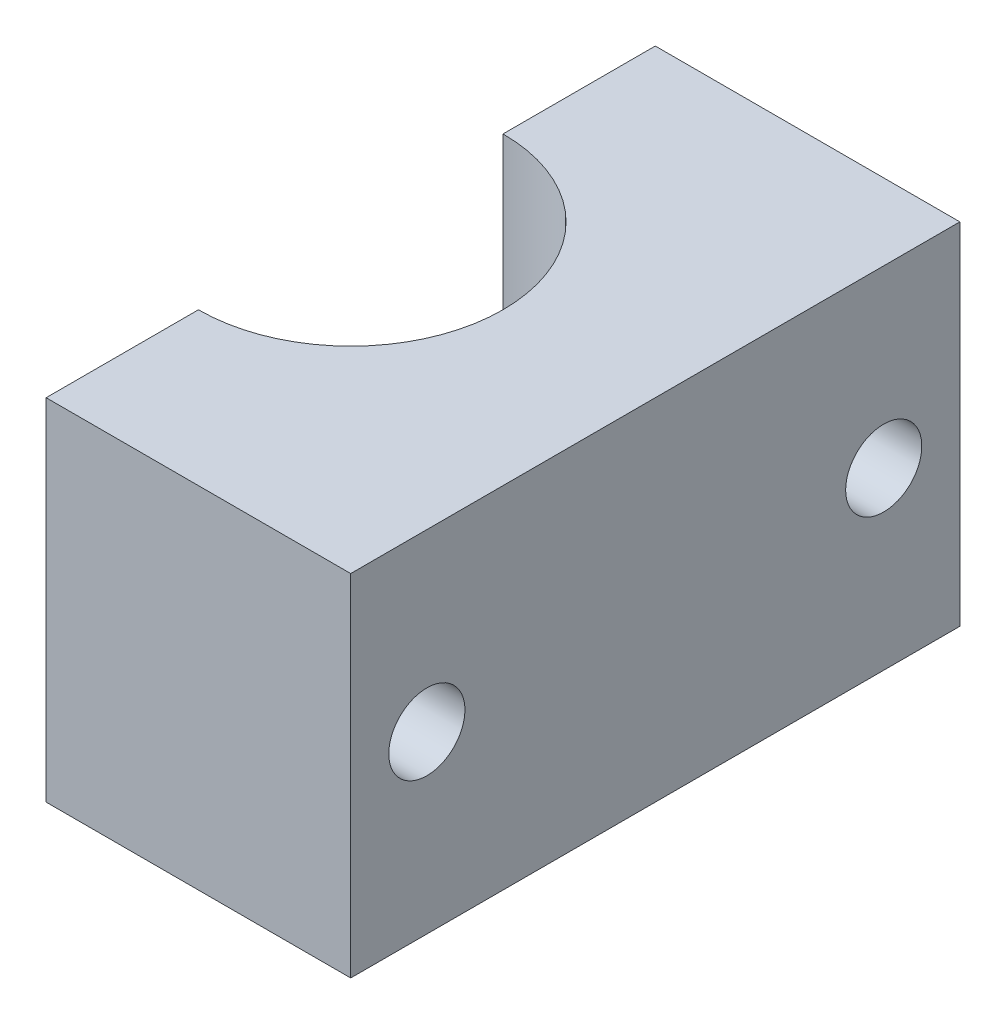
from build123d import *

# Parameters (mm, degrees)
SKETCH1_W           = 25.4
SKETCH1_H           = 50.8
BOSS_EXTRUDE1_DEPTH = 29.21
SKETCH2_R           = 12.7
CUT_EXTRUDE1_DEPTH  = 64.86723808
SKETCH4_R           = 3.175
CUT_EXTRUDE2_DEPTH  = 64.86723808
SKETCH5_R           = 3.175
CUT_EXTRUDE3_DEPTH  = 64.86723808


with BuildPart() as part:
    # Sketch1 → Boss-Extrude1 (new body)
    with BuildSketch(Plane(origin=(0, 0, 0), x_dir=(1, 0, 0), z_dir=(0, 1, 0))):
        with Locations((12.7, 25.4)):
            Rectangle(SKETCH1_W, SKETCH1_H)
    extrude(amount=BOSS_EXTRUDE1_DEPTH)

    # Sketch2 → Cut-Extrude1 (cut, through all)
    with BuildSketch(Plane(origin=(0, 29.21, 0), x_dir=(1, 0, 0), z_dir=(0, 1, 0))):
        with Locations((0, 25.4)):
            Circle(SKETCH2_R)
    extrude(amount=-CUT_EXTRUDE1_DEPTH, mode=Mode.SUBTRACT)

    # Sketch4 → Cut-Extrude2 (cut, through all)
    with BuildSketch(Plane.ZY):
        with Locations((-44.45, 14.605)):
            Circle(SKETCH4_R)
    extrude(amount=-CUT_EXTRUDE2_DEPTH, mode=Mode.SUBTRACT)

    # Sketch5 → Cut-Extrude3 (cut, through all)
    with BuildSketch(Plane.ZY):
        with Locations((-6.35, 14.605)):
            Circle(SKETCH5_R)
    extrude(amount=-CUT_EXTRUDE3_DEPTH, mode=Mode.SUBTRACT)


solid = part.part
